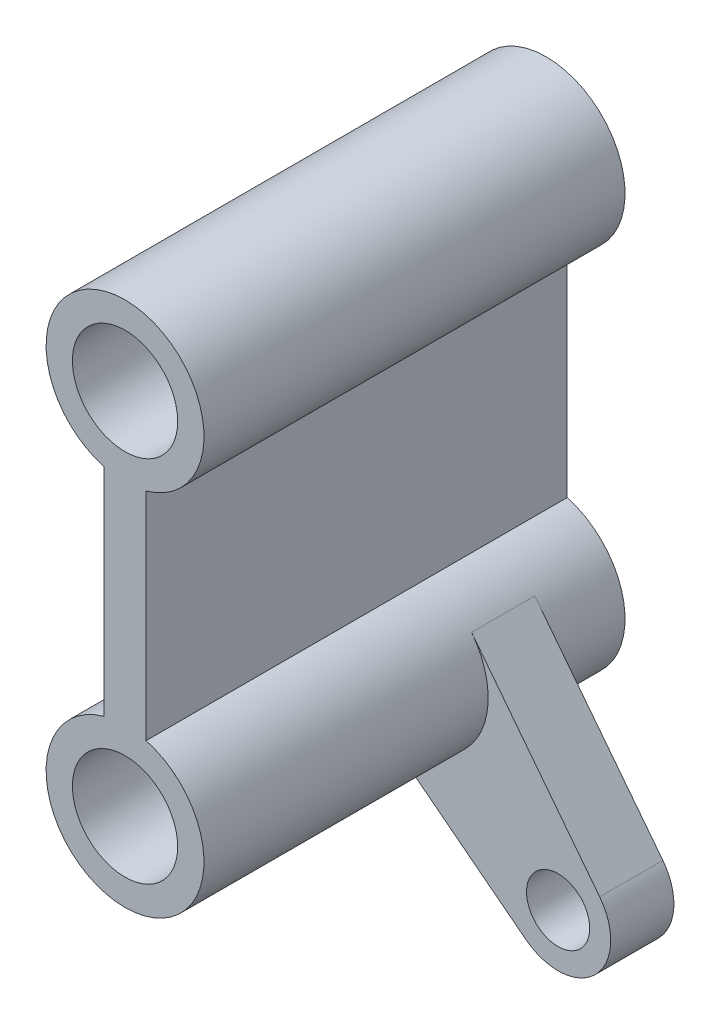
from build123d import *

# Parameters (mm, degrees)
SKETCH_1_R          = 7.5
SKETCH_1_R_2        = 5
SKETCH_1_W          = 4
SKETCH_1_H          = 25
EXTRUDE_1_DEPTH     = 40
SKETCH_3_R          = 5
EXTRUDE_2_DEPTH     = 3
SKETCH_4_R          = 3
CUT_EXTRUDE_2_DEPTH = 54.867163989


with BuildPart() as part:
    # Эскиз1 → Бобышка-Вытянуть1 (new body)
    # profile 1 of 3: a face of its own
    with BuildSketch(Plane.XY):
        Circle(SKETCH_1_R)
        Circle(SKETCH_1_R_2, mode=Mode.SUBTRACT)
    # profile 2 of 3: a face of its own
    with BuildSketch(Plane.XY):
        with Locations((0, 35)):
            Circle(SKETCH_1_R)
        with Locations((0, 35)):
            Circle(SKETCH_1_R_2, mode=Mode.SUBTRACT)
    # profile 3 of 3: a face of its own
    with BuildSketch(Plane.XY):
        with Locations((0, 17.5)):
            Rectangle(SKETCH_1_W, SKETCH_1_H)
    extrude(amount=EXTRUDE_1_DEPTH)

    # Эскиз3 → Бобышка-Вытянуть2 (add, symmetric)
    with BuildSketch(Plane(origin=(0, 0, 10), x_dir=(-1, 0, 0), z_dir=(0, 0, -1))):
        with BuildLine():
            Line((-5.924618308, 4.598793093), (-18.091881162, -11.076273562))
            ThreePointArc((-18.091881162, -11.076273562), (-12.52175414, -9.411980886), (-9.142135624, -14.142135624))
            ThreePointArc((-9.142135624, -14.142135624), (-9.651628397, -16.34107738), (-11.076273562, -18.091881162))
            Line((-11.076273562, -18.091881162), (4.598793093, -5.924618308))
            Line((4.598793093, -5.924618308), (3.065862062, -3.949745538))
            ThreePointArc((3.065862062, -3.949745538), (-3.535533906, -3.535533906), (-3.949745538, 3.065862062))
            Line((-3.949745538, 3.065862062), (-5.924618308, 4.598793093))
        make_face()
        with Locations((-14.142135624, -14.142135624)):
            Circle(SKETCH_3_R)
    extrude(amount=EXTRUDE_2_DEPTH, both=True)

    # Эскиз4 → Вырез-Вытянуть2 (cut, through all)
    with BuildSketch(Plane.XY.offset(13)):
        with Locations((14.142135624, -14.142135624)):
            Circle(SKETCH_4_R)
    extrude(amount=-CUT_EXTRUDE_2_DEPTH, mode=Mode.SUBTRACT)


solid = part.part
